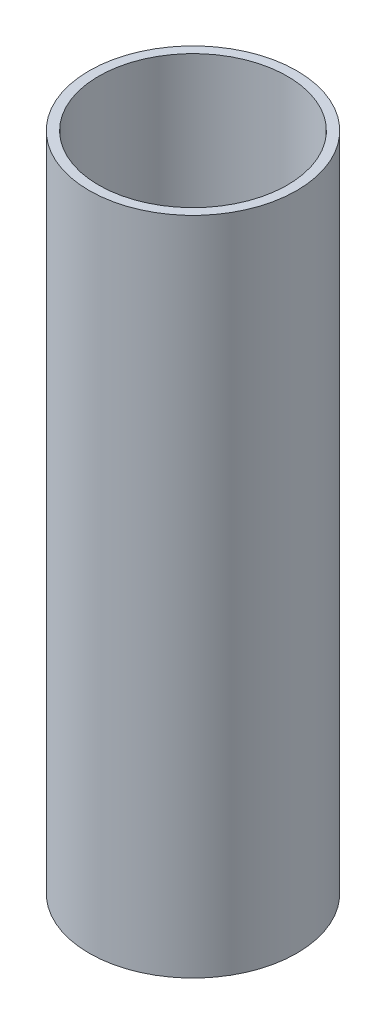
from build123d import *

# Parameters (mm, degrees)
CROQUIS1_R              = 55
SALIENTE_EXTRUIR1_DEPTH = 350
CROQUIS3_R              = 50
CORTAR_EXTRUIR1_DEPTH   = 350


with BuildPart() as part:
    # Croquis1 → Saliente-Extruir1 (new body)
    with BuildSketch(Plane(origin=(0, 0, 0), x_dir=(1, 0, 0), z_dir=(0, 1, 0))):
        with Locations(Location((0, 0, 0), (0, 0, 270))):
            Circle(CROQUIS1_R)
    extrude(amount=SALIENTE_EXTRUIR1_DEPTH)

    # Croquis3 → Cortar-Extruir1 (cut)
    with BuildSketch(Plane(origin=(0, 350, 0), x_dir=(1, 0, 0), z_dir=(0, 1, 0))):
        with Locations(Location((0, 0, 0), (0, 0, 270))):
            Circle(CROQUIS3_R)
    extrude(amount=-CORTAR_EXTRUIR1_DEPTH, mode=Mode.SUBTRACT)


solid = part.part
